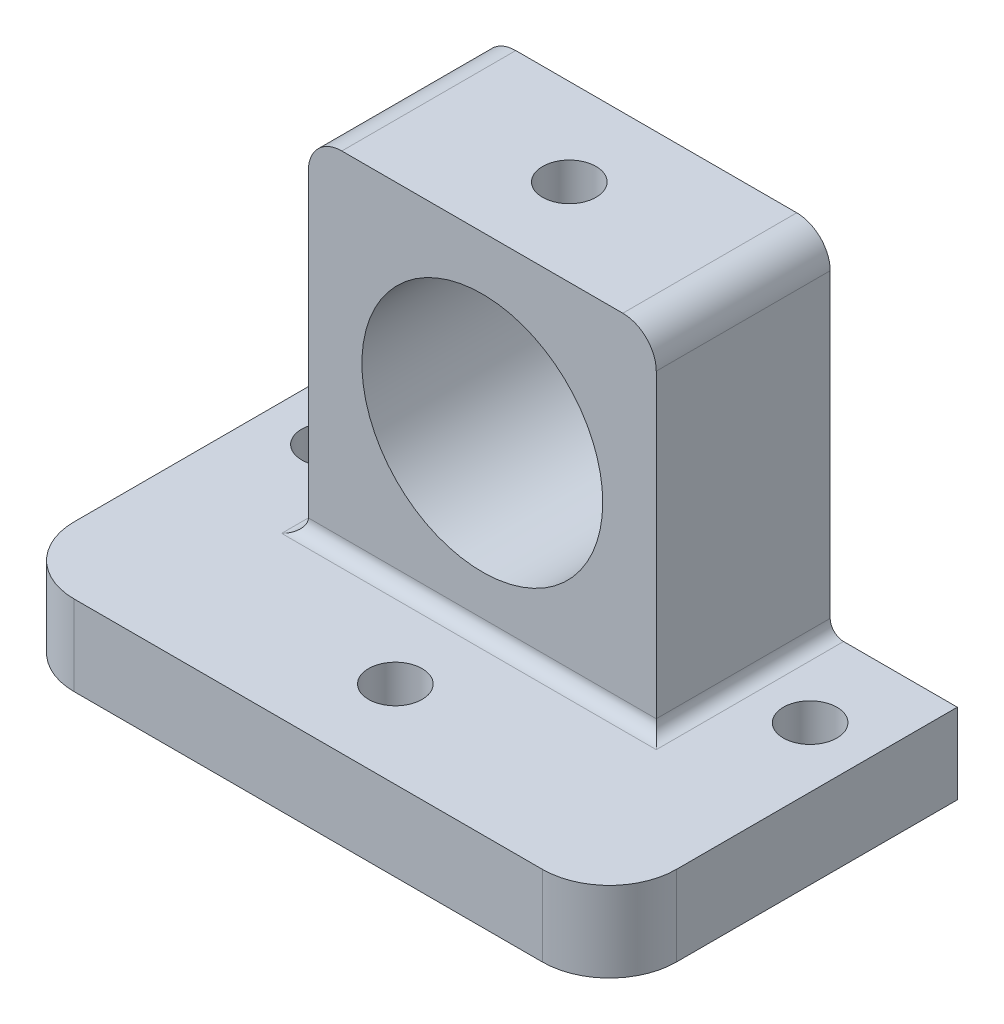
from build123d import *

# Parameters (mm, degrees)
SKETCH1_R           = 2
BOSS_EXTRUDE1_DEPTH = 6
SKETCH1_3_W         = 26
SKETCH1_3_H         = 13
BOSS_EXTRUDE2_DEPTH = 32
FILLET1_R           = 2.5
SKETCH2_R           = 9
CUT_EXTRUDE1_DEPTH  = 42.221960167
CUT_EXTRUDE2_REACH  = 48.971
SKETCH3_R           = 2
FILLET2_R           = 1


with BuildPart() as part:
    # Sketch1 → Boss-Extrude1 (new body)
    with BuildSketch(Plane(origin=(0, 0, 0), x_dir=(1, 0, 0), z_dir=(0, 1, 0))):
        with BuildLine():
            Line((-13, 0), (-22.5, 0))
            Line((-22.5, 0), (-22.5, -21))
            ThreePointArc((-22.5, -21), (-21.035533906, -24.535533906), (-17.5, -26))
            Line((-17.5, -26), (17.5, -26))
            ThreePointArc((17.5, -26), (21.035533906, -24.535533906), (22.5, -21))
            Line((22.5, -21), (22.5, 0))
            Line((22.5, 0), (13, 0))
            Line((13, 0), (13, -13))
            Line((13, -13), (-13, -13))
            Line((-13, -13), (-13, 0))
        make_face()
        with Locations((0, -19.5)):
            Circle(SKETCH1_R, mode=Mode.SUBTRACT)
        with Locations((-18, -6.5)):
            Circle(SKETCH1_R, mode=Mode.SUBTRACT)
        with Locations((18, -6.5)):
            Circle(SKETCH1_R, mode=Mode.SUBTRACT)
    extrude(amount=BOSS_EXTRUDE1_DEPTH)

    # Sketch1<3> → Boss-Extrude2 (add)
    with BuildSketch(Plane(origin=(0, 0, 0), x_dir=(1, 0, 0), z_dir=(0, 1, 0))):
        with Locations((0, -6.5)):
            Rectangle(SKETCH1_3_W, SKETCH1_3_H)
    extrude(amount=BOSS_EXTRUDE2_DEPTH)

    # Fillet1
    fillet1_edges = [part.edges().sort_by_distance(p)[0] for p in [
        (-13, 32, 6.5),
        (13, 32, 6.5),
    ]]
    fillet(fillet1_edges, radius=FILLET1_R)

    # Sketch2 → Cut-Extrude1 (cut, through all)
    with BuildSketch(Plane.XY.offset(13)):
        with Locations((0, 19)):
            Circle(SKETCH2_R)
    extrude(amount=-CUT_EXTRUDE1_DEPTH, mode=Mode.SUBTRACT)

    # Sketch3 → Cut-Extrude2 (cut, up to next)
    with BuildSketch(Plane(origin=(0, 32, 0), x_dir=(1, 0, 0), z_dir=(0, 1, 0)), mode=Mode.PRIVATE) as cut_extrude2_sk1:
        with Locations((0, -6.5)):
            Circle(SKETCH3_R)
    cut_extrude2_tool1 = extrude(cut_extrude2_sk1.sketch, amount=-CUT_EXTRUDE2_REACH, mode=Mode.PRIVATE) & part.part
    add(cut_extrude2_tool1.solids().sort_by_distance((0, 32, 6.5))[0], mode=Mode.SUBTRACT)

    # Fillet2
    fillet2_edges = [part.edges().sort_by_distance(p)[0] for p in [
        (-13, 6, 6.5),
        (0, 6, 13),
        (13, 6, 6.5),
    ]]
    fillet(fillet2_edges, radius=FILLET2_R)


solid = part.part
